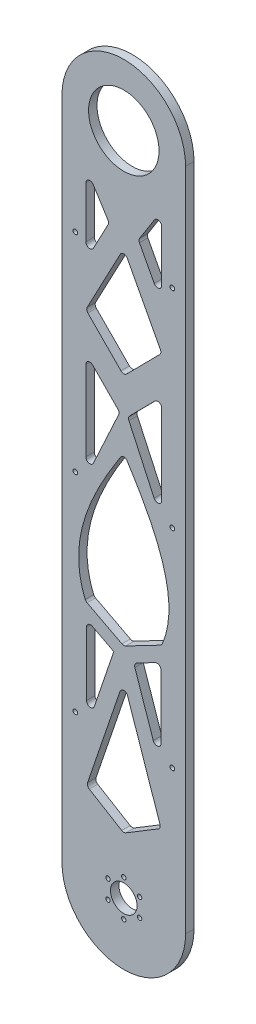
from build123d import *

# Parameters (mm, degrees)
SKETCH2_R           = 10
SKETCH2_R_2         = 1.65
BOSS_EXTRUDE1_DEPTH = 6.35
CUT_EXTRUDE1_DEPTH  = 10
FILLET3_R           = 3
SKETCH5_R           = 1.75
CUT_EXTRUDE2_DEPTH  = 549.511460792
SKETCH6_R           = 26.5
CUT_EXTRUDE3_DEPTH  = 10


with BuildPart() as part:
    # Sketch2 → Boss-Extrude1 (new body)
    with BuildSketch(Plane.XY):
        with BuildLine():
            Line((-46.5, 0), (-46.5, 500))
            ThreePointArc((-46.5, 500), (0, 546.5), (46.5, 500))
            Line((46.5, 500), (46.5, 0))
            ThreePointArc((46.5, 0), (0, -46.5), (-46.5, 0))
        make_face()
        Circle(SKETCH2_R, mode=Mode.SUBTRACT)
        with Locations((0, 13.75)):
            Circle(SKETCH2_R_2, mode=Mode.SUBTRACT)
        with Locations((11.907849302, 6.875)):
            Circle(SKETCH2_R_2, mode=Mode.SUBTRACT)
        with Locations((11.907849302, -6.875)):
            Circle(SKETCH2_R_2, mode=Mode.SUBTRACT)
        with Locations((0, -13.75)):
            Circle(SKETCH2_R_2, mode=Mode.SUBTRACT)
        with Locations((-11.907849302, -6.875)):
            Circle(SKETCH2_R_2, mode=Mode.SUBTRACT)
        with Locations((-11.907849302, 6.875)):
            Circle(SKETCH2_R_2, mode=Mode.SUBTRACT)
    extrude(amount=BOSS_EXTRUDE1_DEPTH)

    # Sketch4 → Cut-Extrude1 (cut)
    with BuildSketch(Plane.XY.offset(6.35)):
        Polygon((28.005258112, 59.37595418), (0, 42.411661153), (-28.005258112, 59.37595418), (0, 141.693437584), align=None)
        Polygon((-7.5, 156.905935087), (-28.005258112, 96.633637735), (-28.005258112, 167.582877854), align=None)
        Polygon((28.005258112, 167.582877854), (7.5, 156.905935087), (28.005258112, 96.633637735), align=None)
        with BuildLine():
            Line((0, 164.275138905), (28.550546746, 179.141206521))
            add(Edge.make_bspline(
                [(28.550546746, 179.141206521), (45.32025339, 216.985654627), (19.430092874, 259.790255689), (0, 290.025756679)],
                knots=[0, 0, 0, 0, 1, 1, 1, 1], degree=3))
            add(Edge.make_bspline(
                [(-28.550546746, 179.141206521), (-45.32025339, 216.985654627), (-19.430092874, 259.790255689), (0, 290.025756679)],
                knots=[0, 0, 0, 0, 1, 1, 1, 1], degree=3))
            Line((-28.550546746, 179.141206521), (0, 164.275138905))
        make_face()
        Polygon((28.550546746, 259.58677623), (3, 314.938284003), (28.550546746, 340.793051053), align=None)
        Polygon((-3, 314.938284003), (-28.550546746, 340.793051053), (-28.550546746, 259.58677623), align=None)
        Polygon((0, 423.142843498), (-28.550546746, 369.246205395), (0, 340.355718526), (28.550546746, 369.246205395), align=None)
        Polygon((-28.550546746, 462.095190817), (-28.550546746, 401.290241252), (-11, 434.421497018), align=None)
        Polygon((28.550546746, 401.290241252), (11, 434.421497018), (28.550546746, 462.095190817), align=None)
    extrude(amount=-CUT_EXTRUDE1_DEPTH, mode=Mode.SUBTRACT)

    # Fillet3
    fillet3_edges = [part.edges().sort_by_distance(p)[0] for p in [
        (-11, 434.421497018, 3.175),
        (-28.550546746, 401.290241252, 3.175),
        (28.550546746, 401.290241252, 3.175),
        (11, 434.421497018, 3.175),
        (28.550546746, 462.095190817, 3.175),
        (-28.550546746, 462.095190817, 3.175),
        (0, 423.142843498, 3.175),
        (-28.550546746, 369.246205395, 3.175),
        (28.550546746, 369.246205395, 3.175),
        (0, 340.355718526, 3.175),
        (28.550546746, 340.793051053, 3.175),
        (-28.550546746, 340.793051053, 3.175),
        (-3, 314.938284003, 3.175),
        (3, 314.938284003, 3.175),
        (28.550546746, 259.58677623, 3.175),
        (-28.550546746, 259.58677623, 3.175),
        (28.550546746, 179.141206521, 3.175),
        (0, 290.025756679, 3.175),
        (-28.550546746, 179.141206521, 3.175),
        (0, 164.275138905, 3.175),
        (-28.005258112, 96.633637735, 3.175),
        (28.005258112, 96.633637735, 3.175),
        (7.5, 156.905935087, 3.175),
        (-28.005258112, 167.582877854, 3.175),
        (28.005258112, 167.582877854, 3.175),
        (0, 141.693437584, 3.175),
        (28.005258112, 59.37595418, 3.175),
        (-28.005258112, 59.37595418, 3.175),
        (0, 42.411661153, 3.175),
    ]]
    fillet(fillet3_edges, radius=FILLET3_R)

    # Sketch5 → Cut-Extrude2 (cut, through all)
    with BuildSketch(Plane.XY.offset(6.35)):
        with Locations((36.5, 103.175)):
            Circle(SKETCH5_R)
        with Locations(Location((-36.5, 103.175, 0), (0, 0, 180))):
            Circle(SKETCH5_R)
        with Locations(Location((36.5, 259.525, 0), (0, 0, 180))):
            Circle(SKETCH5_R)
        with Locations((-36.5, 259.525)):
            Circle(SKETCH5_R)
        with Locations((36.5, 415.875)):
            Circle(SKETCH5_R)
        with Locations(Location((-36.5, 415.875, 0), (0, 0, 180))):
            Circle(SKETCH5_R)
    extrude(amount=-CUT_EXTRUDE2_DEPTH, mode=Mode.SUBTRACT)

    # Sketch6 → Cut-Extrude3 (cut)
    with BuildSketch(Plane.XY.offset(6.35)):
        with Locations((0, 500)):
            Circle(SKETCH6_R)
    extrude(amount=-CUT_EXTRUDE3_DEPTH, mode=Mode.SUBTRACT)


solid = part.part
